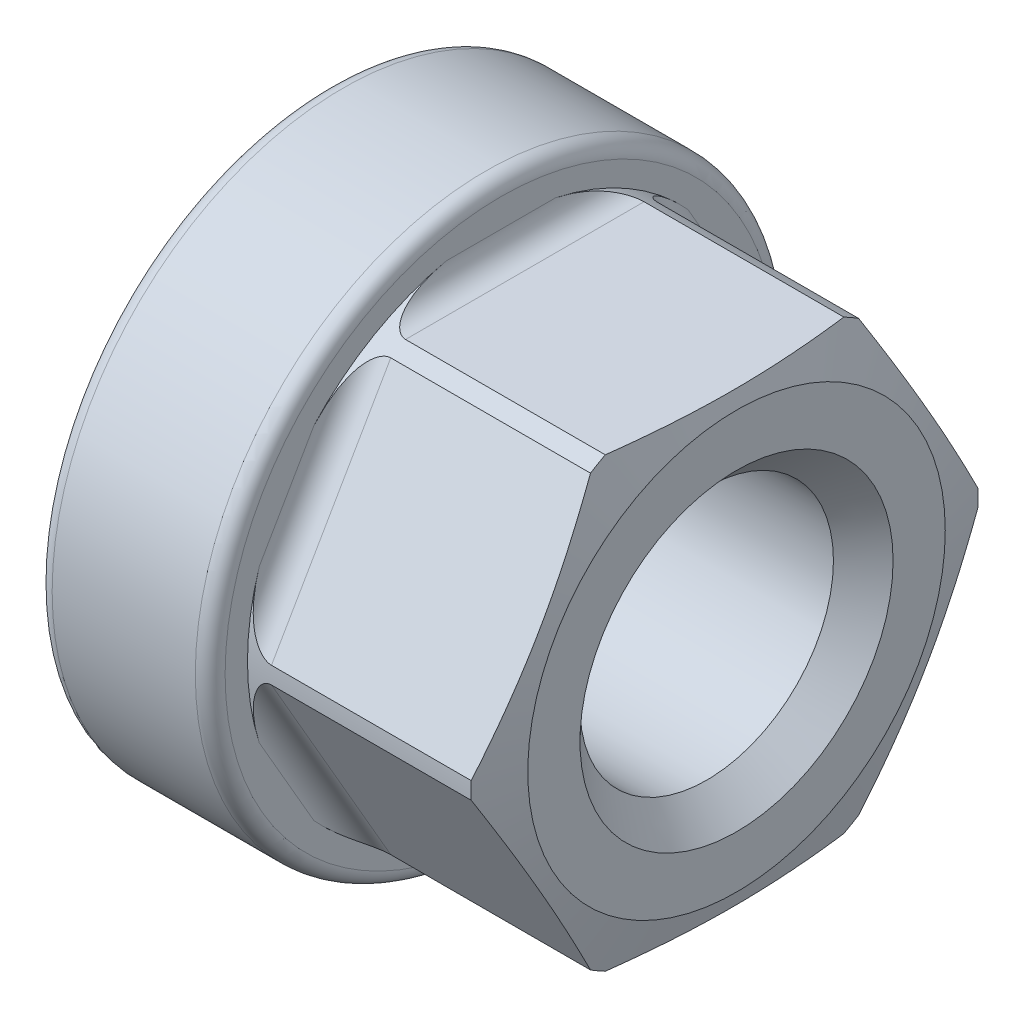
from build123d import *

# Parameters (mm, degrees)
SKETCH2_OUTSIDE_W  = 27.658
SKETCH2_OUTSIDE_H  = 27.658
CUT_EXTRUDE1_DEPTH = 7.9
FILLET1_R          = 0.5
FILLET2_R          = 0.8


with BuildPart() as part:
    # Sketch1 → Revolve1 (revolve)
    with BuildSketch(Plane.XY, mode=Mode.PRIVATE) as revolve1_sk:
        Polygon((0, 5.25), (0, 7), (-0.401923789, 8.5), (-7.9, 8.5), (-7.9, 9.75), (-13.7, 9.75), (-13.7, 5.25), (-12.7, 4.25), (-1, 4.25), align=None)
    revolve(revolve1_sk.sketch.rotate(Axis((0, 0, 0), (-1, 0, 0)), 90), axis=Axis((0, 0, 0), (-1, 0, 0)))

    # Sketch2 outside → Cut-Extrude1 (cut)
    with BuildSketch(Plane(origin=(0, 0, 0), x_dir=(0, 0, -1), z_dir=(1, 0, 0))):
        Rectangle(SKETCH2_OUTSIDE_W, SKETCH2_OUTSIDE_H)
        Polygon((8.660254038, 0), (4.330127019, 7.5), (-4.330127019, 7.5), (-8.660254038, 0), (-4.330127019, -7.5), (4.330127019, -7.5), align=None, mode=Mode.SUBTRACT)
    extrude(amount=-CUT_EXTRUDE1_DEPTH, mode=Mode.SUBTRACT)

    # Fillet1
    fillet1_edges = [part.edges().sort_by_distance(p)[0] for p in [
        (-7.9, 0, 9.75),
        (-13.7, 0, 9.75),
    ]]
    fillet(fillet1_edges, radius=FILLET1_R)

    # Fillet2
    fillet2_edges = [part.edges().sort_by_distance(p)[0] for p in [
        (-7.9, 3.75, -6.495190528),
        (-7.9, 7.5, 0),
        (-7.9, 3.75, 6.495190528),
        (-7.9, -3.75, 6.495190528),
        (-7.9, -7.5, 0),
        (-7.9, -3.75, -6.495190528),
    ]]
    fillet(fillet2_edges, radius=FILLET2_R)


solid = part.part
